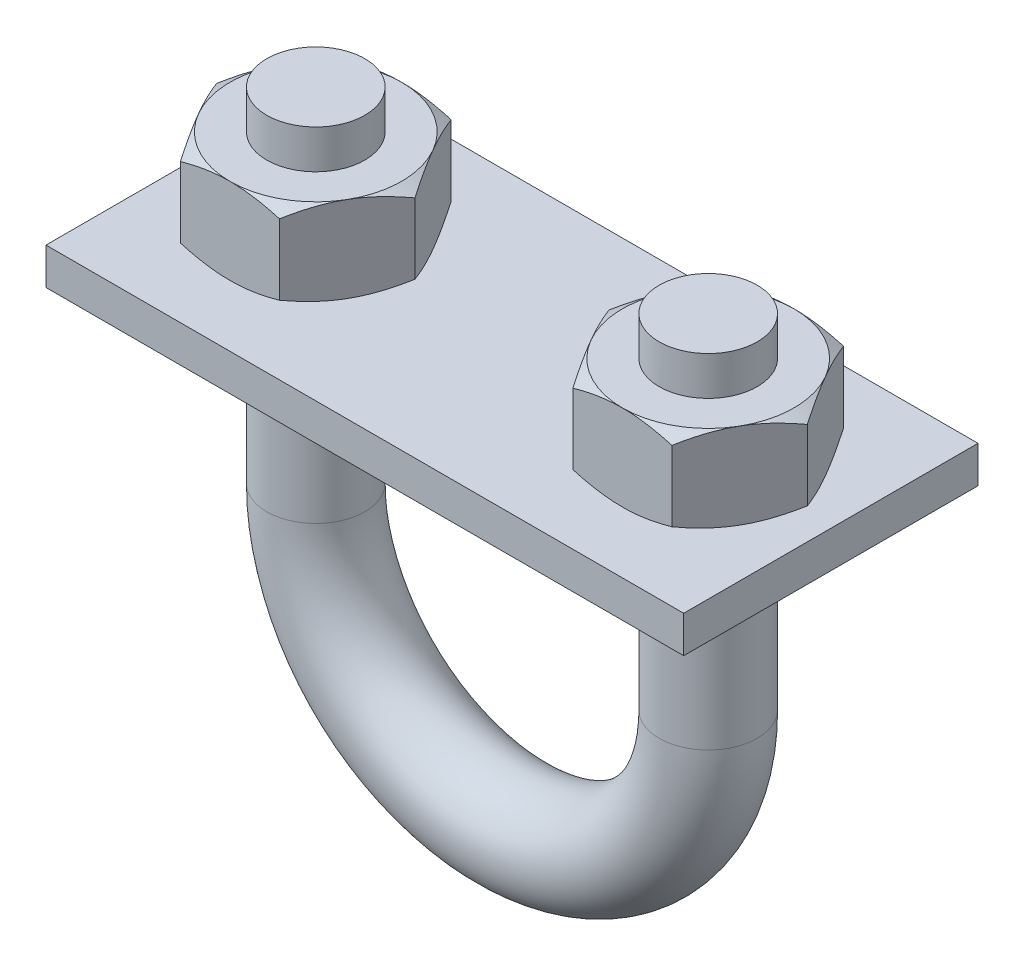
from build123d import *

# Parameters (mm, degrees)
SKETCH2_R           = 3.175
BOSS_EXTRUDE1_DEPTH = 15.875
SKETCH7_R           = 3.175
SKETCH9_R           = 3.175
BOSS_EXTRUDE2_DEPTH = 2.778125
SKETCH10_OUTSIDE_W  = 192.289
SKETCH10_OUTSIDE_H  = 168.41
SKETCH10_OUTSIDE_R  = 5.55625
CUT_EXTRUDE1_DEPTH  = 41.775997027
CUT_EXTRUDE1_DRAFT  = -60
SKETCH11_OUTSIDE_W  = 175.845
SKETCH11_OUTSIDE_H  = 151.966
SKETCH11_OUTSIDE_R  = 5.55625
CUT_EXTRUDE2_DEPTH  = 37.029145539
CUT_EXTRUDE2_DRAFT  = -60
SKETCH12_W          = 41.275
SKETCH12_H          = 19.05
BOSS_EXTRUDE3_DEPTH = 2.38125


with BuildPart() as part:
    # Sketch2 → Boss-Extrude1 (new body)
    with BuildSketch(Plane(origin=(0, 22.225, 0), x_dir=(-1, 0, 0), z_dir=(0, 1, 0))):
        with Locations(Location((12.7, 0, 0), (0, 0, 90))):
            Circle(SKETCH2_R)
    extrude(amount=-BOSS_EXTRUDE1_DEPTH)


with BuildPart() as body_2:
    # Sweep1: sweep along a path in Sketch8
    with BuildLine(Plane.XY) as sweep1_path:
        Line((-12.7, 6.35), (-12.7, 0))
        ThreePointArc((-12.7, 0), (0, -12.7), (12.7, 0))
        Line((12.7, 0), (12.7, 6.35))
    # Sketch7 → Sweep1 (sweep)
    with BuildSketch(Plane(origin=(0, 6.35, 0), x_dir=(-1, 0, 0), z_dir=(0, 1, 0))):
        with Locations((12.7, 0)):
            Circle(SKETCH7_R)
    sweep(path=sweep1_path.line)


with BuildPart() as body_3:
    # Body-Move/Copy1: copy of part
    add(part.part.moved(Location((25.4, 0, 0))))


with BuildPart() as part_1:
    add(part.part)

    # Combine1: union body 2, body 3
    add(body_2.part)
    add(body_3.part)


with BuildPart() as body_2_2:
    # Sketch9 → Boss-Extrude2 (new, symmetric)
    with BuildSketch(Plane(origin=(0, 16.933333333, 0), x_dir=(-1, 0, 0), z_dir=(0, 1, 0))):
        Polygon((-15.907902433, 5.55625), (-19.115804866, 0), (-15.907902433, -5.55625), (-9.492097567, -5.55625), (-6.284195134, 0), (-9.492097567, 5.55625), align=None)
        with Locations(Location((-12.7, 0, 0), (0, 0, 90))):
            Circle(SKETCH9_R, mode=Mode.SUBTRACT)
    extrude(amount=BOSS_EXTRUDE2_DEPTH, both=True)


with BuildPart() as cut_extrude1_tool:
    # Sketch10 outside → Cut-Extrude1 (with draft: the straight prism first)
    with BuildSketch(Plane(origin=(0, 19.711458333, 0), x_dir=(1, 0, 0), z_dir=(0, 1, 0))):
        with Locations((1.6205, 0)):
            Rectangle(SKETCH10_OUTSIDE_W, SKETCH10_OUTSIDE_H)
        with Locations((12.7, 0)):
            Circle(SKETCH10_OUTSIDE_R, mode=Mode.SUBTRACT)
    extrude(amount=-CUT_EXTRUDE1_DEPTH)
    # Cut-Extrude1: the draft: its side faces are tilted about the plane it starts from
    cut_extrude1_sides = [cut_extrude1_tool.faces().sort_by_distance(p)[0] for p in [
        (1.6205, -1.17654018, 84.205),
        (97.765, -1.17654018, 0),
        (1.6205, -1.17654018, -84.205),
        (-94.524, -1.17654018, 0),
        (7.14375, -1.17654018, 0),
    ]]
    draft(cut_extrude1_sides, Plane(origin=(0, 19.711458333, 0), x_dir=(1, 0, 0), z_dir=(0, 1, 0)), CUT_EXTRUDE1_DRAFT)


with BuildPart() as body_2_2_1:
    add(body_2_2.part)

    # Cut-Extrude1: cut by cut_extrude1_tool
    add(cut_extrude1_tool.part, mode=Mode.SUBTRACT)


with BuildPart() as cut_extrude2_tool:
    # Sketch11 outside → Cut-Extrude2 (with draft: the straight prism first)
    with BuildSketch(Plane.XZ.offset(-14.155208333)):
        with Locations((1.6205, 0)):
            Rectangle(SKETCH11_OUTSIDE_W, SKETCH11_OUTSIDE_H)
        with Locations((12.7, 0)):
            Circle(SKETCH11_OUTSIDE_R, mode=Mode.SUBTRACT)
    extrude(amount=-CUT_EXTRUDE2_DEPTH)
    # Cut-Extrude2: the draft: its side faces are tilted about the plane it starts from
    cut_extrude2_sides = [cut_extrude2_tool.faces().sort_by_distance(p)[0] for p in [
        (1.6205, 32.669781103, -75.983),
        (89.543, 32.669781103, 0),
        (1.6205, 32.669781103, 75.983),
        (-86.302, 32.669781103, 0),
        (7.14375, 32.669781103, 0),
    ]]
    draft(cut_extrude2_sides, Plane.XZ.offset(-14.155208333), CUT_EXTRUDE2_DRAFT)


with BuildPart() as body_2_2_2:
    add(body_2_2_1.part)

    # Cut-Extrude2: cut by cut_extrude2_tool
    add(cut_extrude2_tool.part, mode=Mode.SUBTRACT)


with BuildPart() as body_3_2:
    # Body-Move/Copy2: copy of body 2 2
    add(body_2_2_2.part.moved(Location((-25.4, 0, 0))))


with BuildPart() as body_4:
    # Sketch12 → Boss-Extrude3 (new body)
    with BuildSketch(Plane(origin=(0, 14.155208333, 0), x_dir=(1, 0, 0), z_dir=(0, 1, 0))):
        Rectangle(SKETCH12_W, SKETCH12_H)
    extrude(amount=-BOSS_EXTRUDE3_DEPTH)


solid = Compound([part_1.part, body_2_2_2.part, body_3_2.part, body_4.part])
